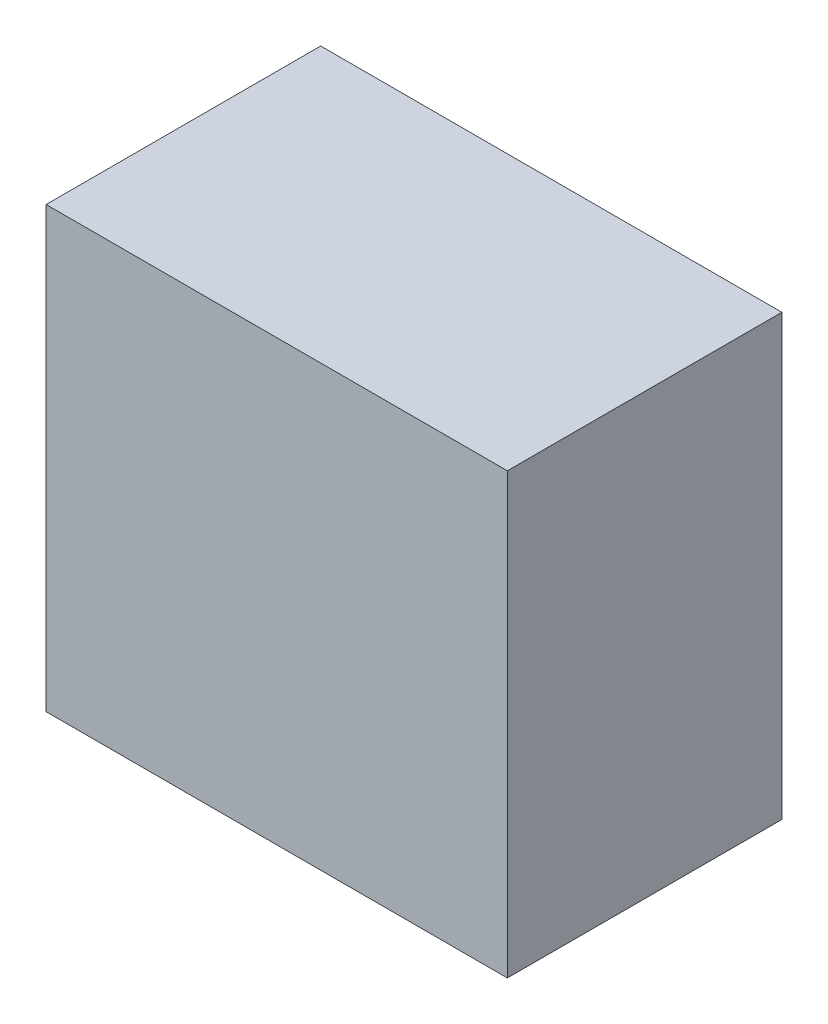
from build123d import *

# Parameters (mm, degrees)
SKETCH1_W           = 84
SKETCH1_H           = 50
BOSS_EXTRUDE1_DEPTH = 80


with BuildPart() as part:
    # Sketch1 → Boss-Extrude1 (new body)
    with BuildSketch(Plane(origin=(0, 0, 0), x_dir=(1, 0, 0), z_dir=(0, 1, 0))):
        Rectangle(SKETCH1_W, SKETCH1_H)
    extrude(amount=BOSS_EXTRUDE1_DEPTH)


solid = part.part
